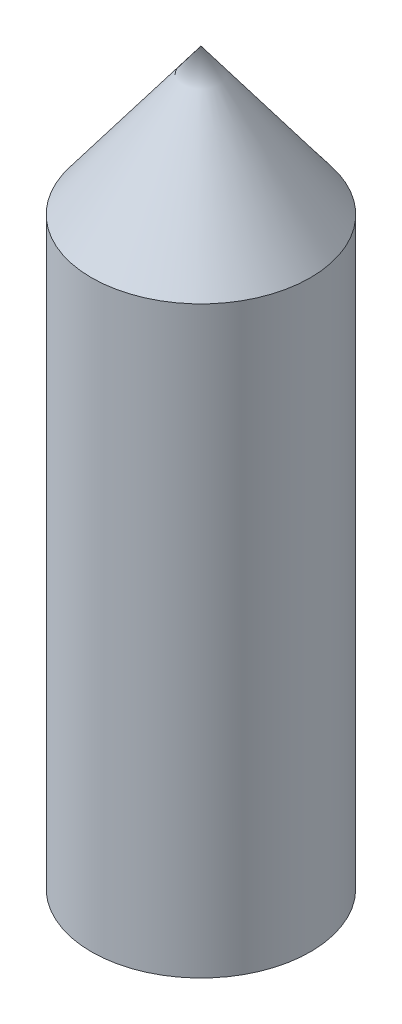
from build123d import *


with BuildPart() as part:
    # Esquisse2 → Révolution1 (revolve)
    with BuildSketch(Plane(origin=(0, 0, 0), x_dir=(0, 0, -1), z_dir=(1, 0, 0))):
        Polygon((0, 0), (-7.5, 0), (-7.5, 40), (0, 50), align=None)
    revolve(axis=Axis((0, 50, 0), (0, -1, 0)))


solid = part.part
